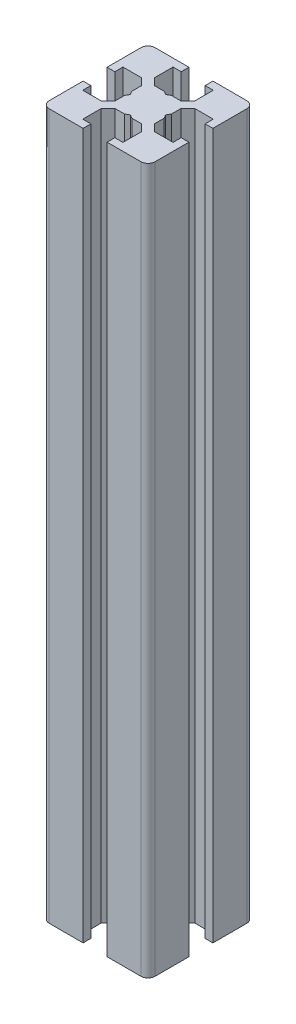
from build123d import *

# Parameters (mm, degrees)
BOSS_EXTRUDE1_DEPTH = 100


with BuildPart() as part:
    # Sketch2 → Boss-Extrude1 (new body)
    with BuildSketch(Plane(origin=(0, 0, 0), x_dir=(1, 0, 0), z_dir=(0, 1, 0))):
        with BuildLine():
            Line((1.7, 7.5), (6.5, 7.5))
            ThreePointArc((6.5, 7.5), (7.207106781, 7.207106781), (7.5, 6.5))
            Line((7.5, 6.5), (7.5, 1.7))
            Line((7.5, 1.7), (6.4, 1.7))
            Line((6.4, 1.7), (6.4, 2.85))
            Line((6.4, 2.85), (3.8, 2.85))
            Line((3.8, 2.85), (2.8, 1.85))
            Line((2.8, 1.85), (2.8, 0.519615242))
            Line((2.8, 0.519615242), (2.5, 0))
            Line((2.5, 0), (2.8, -0.519615242))
            Line((2.8, -0.519615242), (2.8, -1.85))
            Line((2.8, -1.85), (3.8, -2.85))
            Line((3.8, -2.85), (6.4, -2.85))
            Line((6.4, -2.85), (6.4, -1.7))
            Line((6.4, -1.7), (7.5, -1.7))
            Line((7.5, -1.7), (7.5, -6.5))
            ThreePointArc((7.5, -6.5), (7.207106781, -7.207106781), (6.5, -7.5))
            Line((6.5, -7.5), (1.7, -7.5))
            Line((1.7, -7.5), (1.7, -6.4))
            Line((1.7, -6.4), (2.85, -6.4))
            Line((2.85, -6.4), (2.85, -3.8))
            Line((2.85, -3.8), (1.85, -2.8))
            Line((1.85, -2.8), (0.519615242, -2.8))
            Line((0.519615242, -2.8), (0, -2.5))
            Line((0, -2.5), (-0.519615242, -2.8))
            Line((-0.519615242, -2.8), (-1.85, -2.8))
            Line((-1.85, -2.8), (-2.85, -3.8))
            Line((-2.85, -3.8), (-2.85, -6.4))
            Line((-2.85, -6.4), (-1.7, -6.4))
            Line((-1.7, -6.4), (-1.7, -7.5))
            Line((-1.7, -7.5), (-6.5, -7.5))
            ThreePointArc((-6.5, -7.5), (-7.207106781, -7.207106781), (-7.5, -6.5))
            Line((-7.5, -6.5), (-7.5, -1.7))
            Line((-7.5, -1.7), (-6.4, -1.7))
            Line((-6.4, -1.7), (-6.4, -2.85))
            Line((-6.4, -2.85), (-3.8, -2.85))
            Line((-3.8, -2.85), (-2.8, -1.85))
            Line((-2.8, -1.85), (-2.8, -0.519615242))
            Line((-2.8, -0.519615242), (-2.5, 0))
            Line((-2.5, 0), (-2.8, 0.519615242))
            Line((-2.8, 0.519615242), (-2.8, 1.85))
            Line((-2.8, 1.85), (-3.8, 2.85))
            Line((-3.8, 2.85), (-6.4, 2.85))
            Line((-6.4, 2.85), (-6.4, 1.7))
            Line((-6.4, 1.7), (-7.5, 1.7))
            Line((-7.5, 1.7), (-7.5, 6.5))
            ThreePointArc((-7.5, 6.5), (-7.207106781, 7.207106781), (-6.5, 7.5))
            Line((-6.5, 7.5), (-1.7, 7.5))
            Line((-1.7, 7.5), (-1.7, 6.4))
            Line((-1.7, 6.4), (-2.85, 6.4))
            Line((-2.85, 6.4), (-2.85, 3.8))
            Line((-2.85, 3.8), (-1.85, 2.8))
            Line((-1.85, 2.8), (-0.519615242, 2.8))
            Line((-0.519615242, 2.8), (0, 2.5))
            Line((0, 2.5), (0.519615242, 2.8))
            Line((0.519615242, 2.8), (1.85, 2.8))
            Line((1.85, 2.8), (2.85, 3.8))
            Line((2.85, 3.8), (2.85, 6.4))
            Line((2.85, 6.4), (1.7, 6.4))
            Line((1.7, 6.4), (1.7, 7.5))
        make_face()
    extrude(amount=BOSS_EXTRUDE1_DEPTH)


solid = part.part
